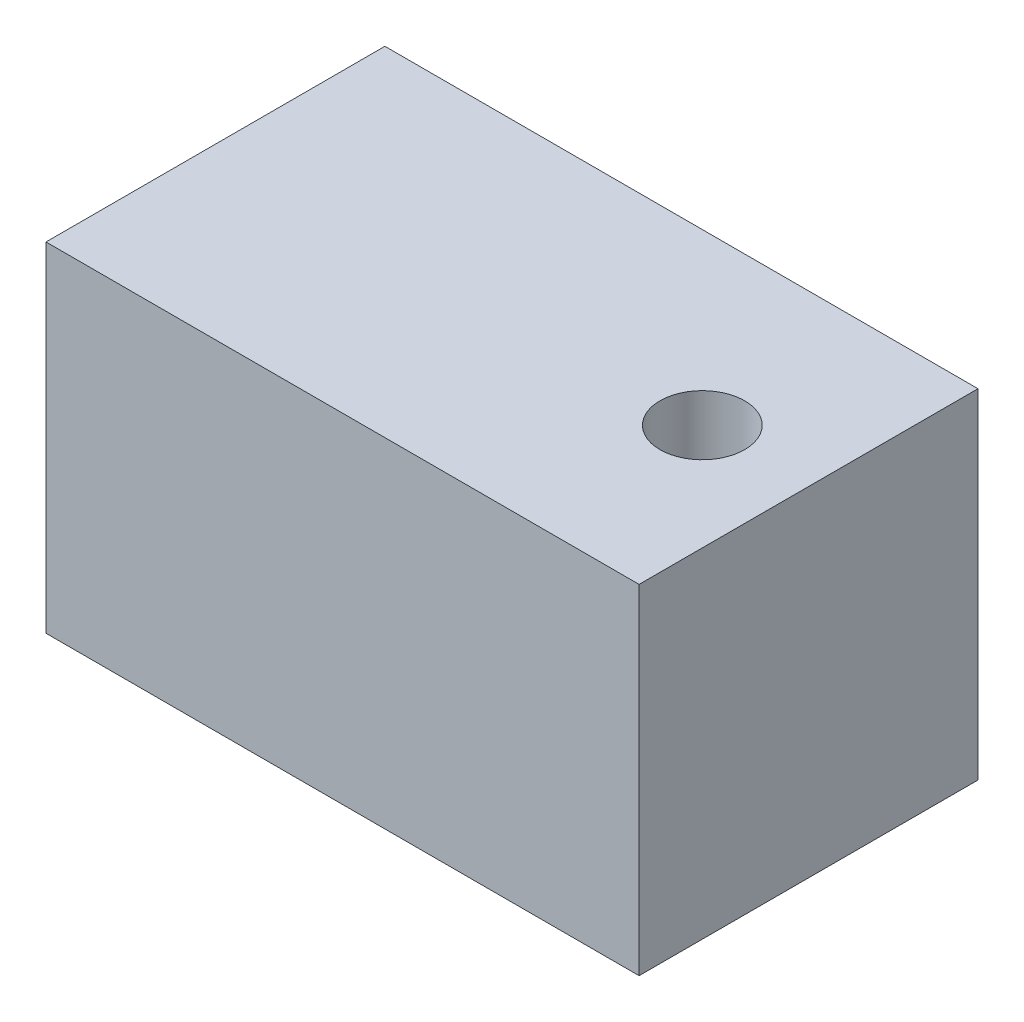
from build123d import *

# Parameters (mm, degrees)
SKETCH1_W                   = 44.45
SKETCH1_H                   = 25.4
BOSS_EXTRUDE1_DEPTH         = 25.4
SKETCH2_R                   = 3.175
CUT_EXTRUDE1_DEPTH          = 58.15
F_3_8_16_TAPPED_HOLE1_D     = 7.9375
F_3_8_16_TAPPED_HOLE1_DEPTH = 25.4
F_3_8_16_TAPPED_HOLE1_TIP   = 2.384665582


with BuildPart() as part:
    # Sketch1 → Boss-Extrude1 (new body)
    with BuildSketch(Plane(origin=(0, 0, 0), x_dir=(1, 0, 0), z_dir=(0, 1, 0))):
        with Locations((22.225, 12.7)):
            Rectangle(SKETCH1_W, SKETCH1_H)
    extrude(amount=BOSS_EXTRUDE1_DEPTH)

    # Sketch2 → Cut-Extrude1 (cut, through all)
    with BuildSketch(Plane(origin=(0, 25.4, 0), x_dir=(1, 0, 0), z_dir=(0, 1, 0))):
        with Locations(Location((36.48842715, 12.7, 0), (0, 0, 270))):
            Circle(SKETCH2_R)
    extrude(amount=-CUT_EXTRUDE1_DEPTH, mode=Mode.SUBTRACT)

    # 3/8-16 Tapped Hole1
    with Locations(Plane.ZY):
        with Locations((-12.7, 12.7)):
            Hole(F_3_8_16_TAPPED_HOLE1_D / 2, depth=F_3_8_16_TAPPED_HOLE1_DEPTH)
            with Locations((0, 0, -(F_3_8_16_TAPPED_HOLE1_DEPTH + F_3_8_16_TAPPED_HOLE1_TIP / 2))):  # 118° drill point
                Cone(0, F_3_8_16_TAPPED_HOLE1_D / 2, F_3_8_16_TAPPED_HOLE1_TIP, mode=Mode.SUBTRACT)


solid = part.part
